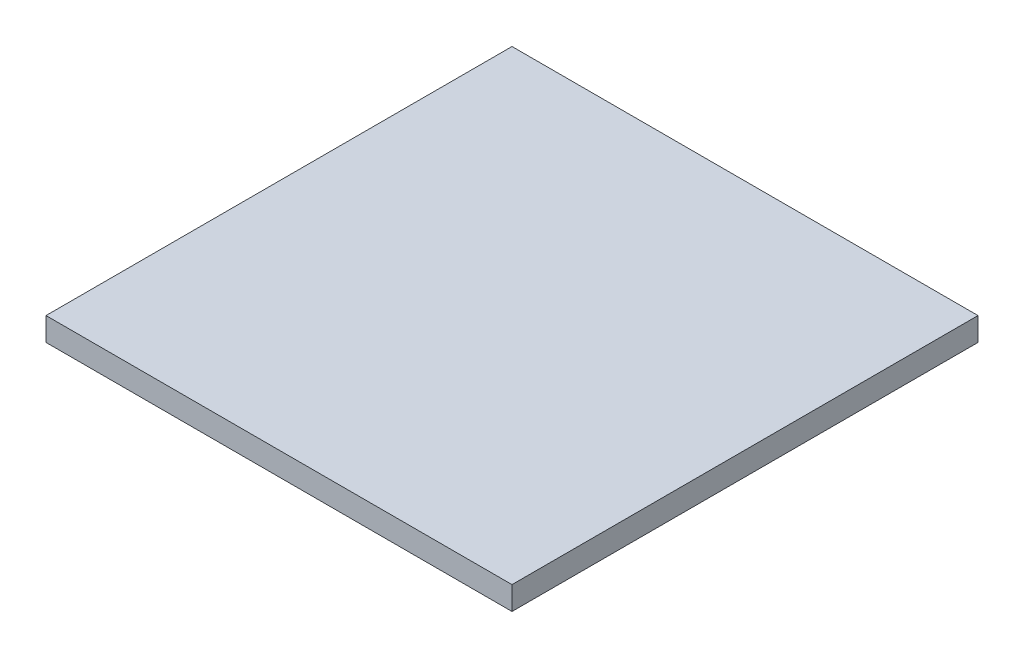
from build123d import *

# Parameters (mm, degrees)
CROQUIS1_W              = 6000
CROQUIS1_H              = 6000
SALIENTE_EXTRUIR1_DEPTH = 300


with BuildPart() as part:
    # Croquis1 → Saliente-Extruir1 (new body)
    with BuildSketch(Plane(origin=(0, 0, 0), x_dir=(1, 0, 0), z_dir=(0, 1, 0))):
        with Locations((3000, 3000)):
            Rectangle(CROQUIS1_W, CROQUIS1_H)
    extrude(amount=SALIENTE_EXTRUIR1_DEPTH)


solid = part.part
